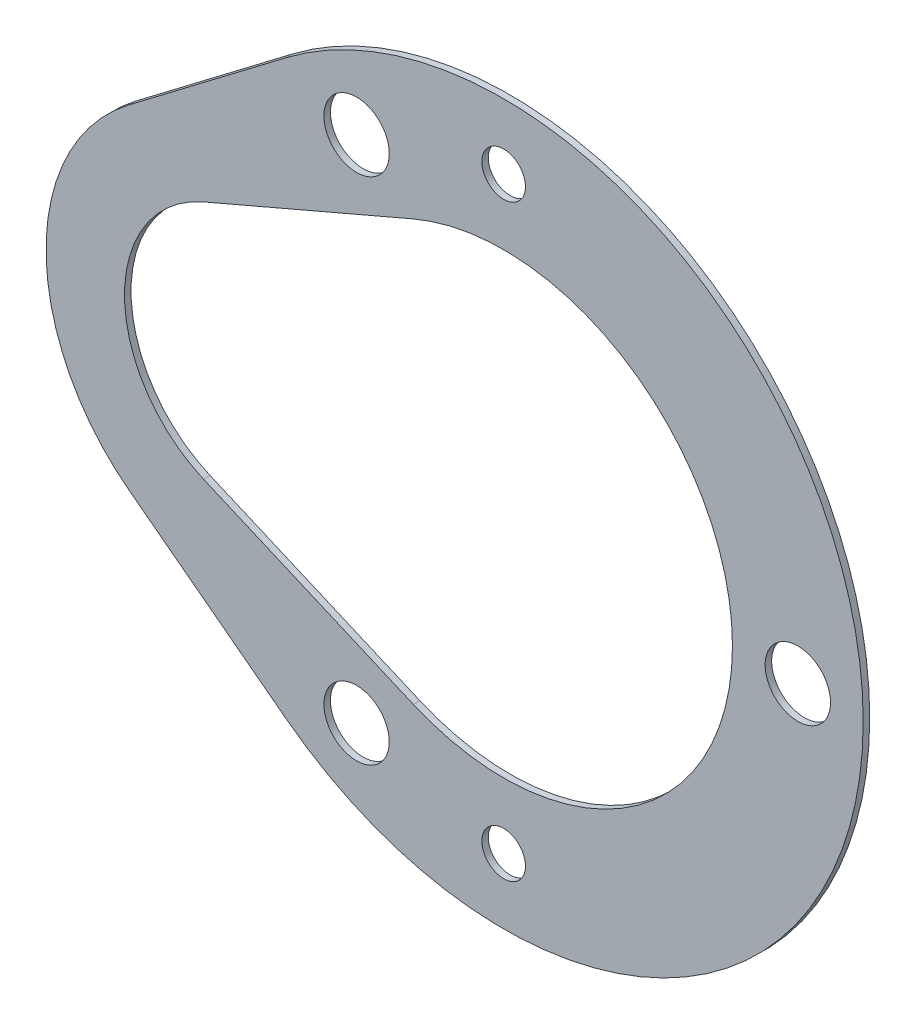
from build123d import *

# Parameters (mm, degrees)
SKETCH_1_R      = 5
EXTRUDE_1_DEPTH = 1
SKETCH_3_R      = 3
SKETCH_2_R      = 3.75


with BuildPart() as part:
    # Эскиз1 → Бобышка-Вытянуть1 (new body)
    with BuildSketch(Plane.XY):
        with BuildLine():
            Line((-57.368421028, 25.472814244), (-33.289473642, 43.781399484))
            ThreePointArc((-33.289473642, 43.781399484), (54.999999965, 0), (-33.289473642, -43.781399484))
            Line((-33.289473642, -43.781399484), (-57.368421028, -25.472814244))
            ThreePointArc((-57.368421028, -25.472814244), (-69.999999979, 0), (-57.368421028, 25.472814244))
        make_face()
        with Locations((-22.5, 38.97114317)):
            Circle(SKETCH_1_R, mode=Mode.SUBTRACT)
        with Locations((45, 0)):
            Circle(SKETCH_1_R, mode=Mode.SUBTRACT)
        with Locations((-22.5, -38.97114317)):
            Circle(SKETCH_1_R, mode=Mode.SUBTRACT)
        with BuildLine():
            Line((-45.894736842, 18.375884474), (-13.815789474, 32.157797829))
            ThreePointArc((-13.815789474, 32.157797829), (35, 0), (-13.815789474, -32.157797829))
            Line((-13.815789474, -32.157797829), (-45.894736842, -18.375884474))
            ThreePointArc((-45.894736842, -18.375884474), (-58, 0), (-45.894736842, 18.375884474))
        make_face(mode=Mode.SUBTRACT)
    extrude(amount=EXTRUDE_1_DEPTH)

    # Эскиз3 → Вырез-По сечениям1 section 0
    with BuildSketch(Plane.XY.offset(21)):
        with Locations((0, 45)):
            Circle(SKETCH_3_R)
    # Эскиз2 → Вырез-По сечениям1 section 1
    with BuildSketch(Plane(origin=(0, 0, -24), x_dir=(-1, 0, 0), z_dir=(0, 0, -1))):
        with Locations((0, 45)):
            Circle(SKETCH_2_R)
    loft_1 = loft(mode=Mode.SUBTRACT)

    # Зеркальное отражение1: Вырез-По сечениям1 across plane
    add(loft_1.mirror(Plane.ZX), mode=Mode.SUBTRACT)


solid = part.part
